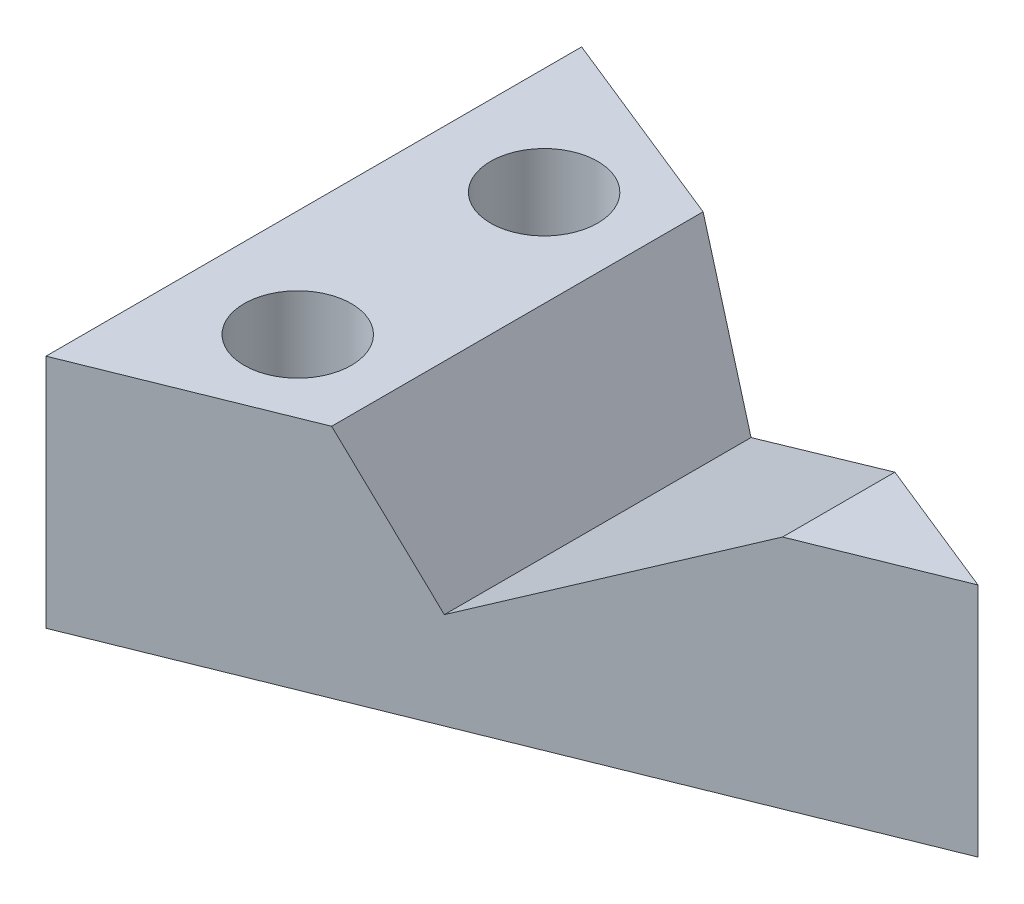
from build123d import *

# Parameters (mm, degrees)
EXTRUDE_1_DEPTH          = 22
CUT_EXTRUDE_1_DEPTH      = 22
CUT_EXTRUDE_1_DEPTH_BACK = 22
SKETCH_4_R               = 5
CUT_EXTRUDE_2_DEPTH      = 22


with BuildPart() as part:
    # 스케치1 → 보스-돌출1 (new body)
    with BuildSketch(Plane(origin=(0, 0, 0), x_dir=(1, 0, 0), z_dir=(0, 1, 0))):
        Polygon((0, 0), (-62, 25), (-62, -25), align=None)
    extrude(amount=EXTRUDE_1_DEPTH)

    # 스케치3 → 컷-돌출1 (cut, two sides: drawn at the far end of the back side and taken through both)
    with BuildSketch(Plane.XY.offset(-CUT_EXTRUDE_1_DEPTH_BACK)):
        Polygon((-35.5, 9.009618943), (-13, 22), (-43, 22), align=None)
    extrude(amount=CUT_EXTRUDE_1_DEPTH + CUT_EXTRUDE_1_DEPTH_BACK, mode=Mode.SUBTRACT)

    # 스케치4 → 컷-돌출2 (cut)
    with BuildSketch(Plane(origin=(0, 22, 0), x_dir=(1, 0, 0), z_dir=(0, 1, 0))):
        with Locations((-52, -11.5)):
            Circle(SKETCH_4_R)
        with Locations((-52, 11.5)):
            Circle(SKETCH_4_R)
    extrude(amount=-CUT_EXTRUDE_2_DEPTH, mode=Mode.SUBTRACT)


solid = part.part
